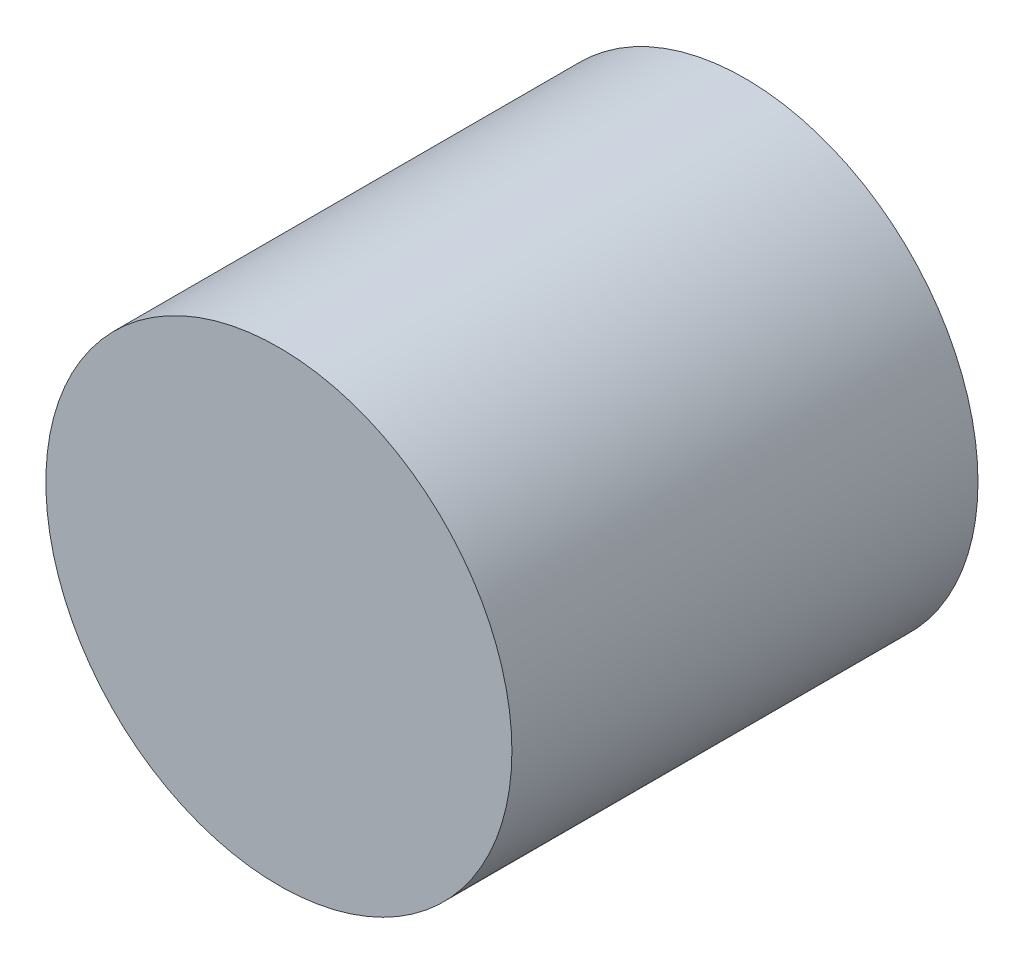
from build123d import *

# Parameters (mm, degrees)
SCHIZZO1_R                   = 12.5
ESTRUSIONE_ESTRUSIONE1_DEPTH = 25


with BuildPart() as part:
    # Schizzo1 → Estrusione-Estrusione1 (new body)
    with BuildSketch(Plane.XY):
        Circle(SCHIZZO1_R)
    extrude(amount=ESTRUSIONE_ESTRUSIONE1_DEPTH)


solid = part.part
